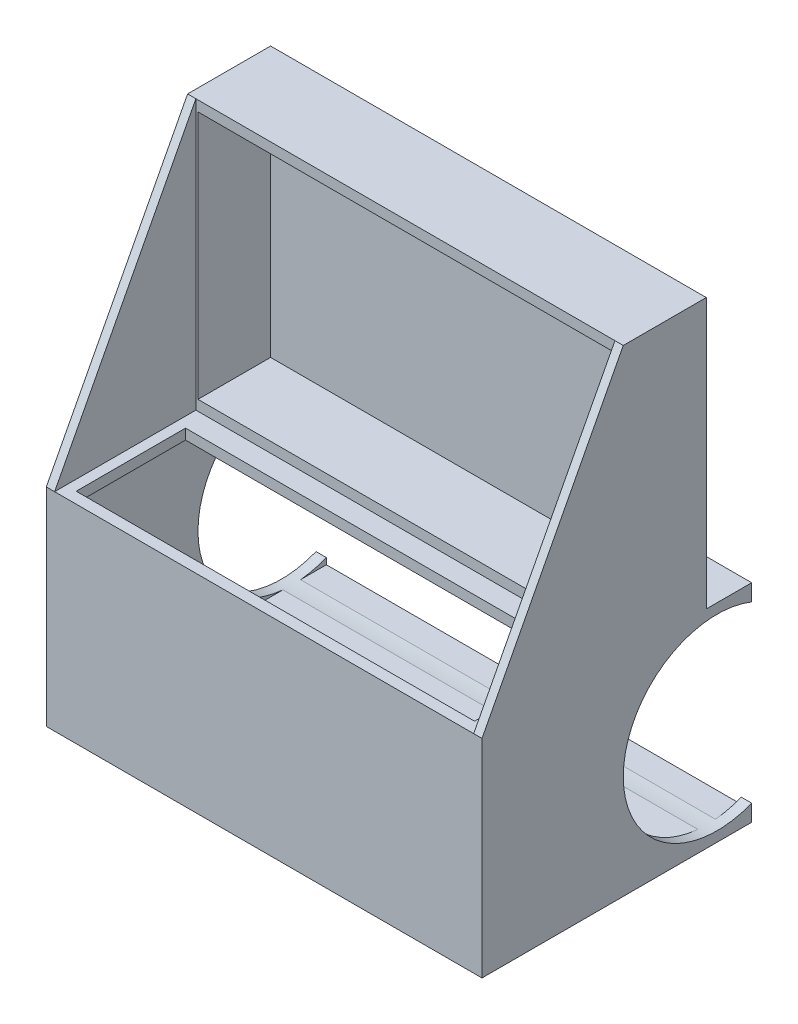
from build123d import *

# Parameters (mm, degrees)
SKETCH_2_W          = 210
SKETCH_2_H          = 100
EXTRUDE_1_DEPTH     = 130
SKETCH_3_W          = 200
SKETCH_3_H          = 90
CUT_EXTRUDE_1_DEPTH = 125
SKETCH_4_W          = 70
SKETCH_4_H          = 85
CUT_EXTRUDE_2_DEPTH = 125
CUT_EXTRUDE_4_DEPTH = 150
EXTRUDE_3_DEPTH     = 210
SKETCH_7_W          = 200
SKETCH_7_H          = 120
CUT_EXTRUDE_7_DEPTH = 35
EXTRUDE_6_DEPTH     = 4
EXTRUDE_7_DEPTH     = 4
SKETCH_13_W         = 192
SKETCH_13_H         = 52.689697424
CUT_EXTRUDE_9_DEPTH = 5


with BuildPart() as part:
    # 草图2 → 凸台-拉伸1 (new body)
    with BuildSketch(Plane.XY):
        Rectangle(SKETCH_2_W, SKETCH_2_H)
    extrude(amount=EXTRUDE_1_DEPTH)

    # 草图3 → 切除-拉伸1 (cut)
    with BuildSketch(Plane.XY):
        Rectangle(SKETCH_3_W, SKETCH_3_H)
    extrude(amount=CUT_EXTRUDE_1_DEPTH, mode=Mode.SUBTRACT)

    # 草图4 → 切除-拉伸2 (cut)
    with BuildSketch(Plane(origin=(0, 0, 0), x_dir=(1, 0, 0), z_dir=(0, 1, 0))):
        with Locations((0, -82.5)):
            Rectangle(SKETCH_4_W, SKETCH_4_H)
    extrude(amount=-CUT_EXTRUDE_2_DEPTH, mode=Mode.SUBTRACT)

    # 草图5 → 切除-拉伸4 (cut, symmetric)
    with BuildSketch(Plane(origin=(0, 0, 0), x_dir=(0, 0, -1), z_dir=(1, 0, 0))):
        with BuildLine():
            Line((0, 42), (0, -42))
            ThreePointArc((0, -42), (-61.900064838, 0), (0, 42))
        make_face()
    extrude(amount=CUT_EXTRUDE_4_DEPTH, both=True, mode=Mode.SUBTRACT)

    # 草图6 → 凸台-拉伸3 (add)
    with BuildSketch(Plane(origin=(105, 0, 0), x_dir=(0, 0, -1), z_dir=(1, 0, 0))):
        Polygon((-61.900064838, 50), (-61.900064838, 174.615745143), (-61.900064838, 180), (-21.900064838, 180), (-21.900064838, 50), align=None)
    extrude(amount=-EXTRUDE_3_DEPTH)

    # 草图7 → 切除-拉伸7 (cut)
    with BuildSketch(Plane.XY.offset(61.900064838)):
        with Locations((0, 115)):
            Rectangle(SKETCH_7_W, SKETCH_7_H)
    extrude(amount=-CUT_EXTRUDE_7_DEPTH, mode=Mode.SUBTRACT)

    # 草图11 → 凸台-拉伸6 (add)
    with BuildSketch(Plane(origin=(105, 0, 0), x_dir=(0, 0, -1), z_dir=(1, 0, 0))):
        Polygon((-130, 50), (-61.900064838, 180), (-61.900064838, 50), align=None)
    extrude(amount=-EXTRUDE_6_DEPTH)

    # 草图12 → 凸台-拉伸7 (add)
    with BuildSketch(Plane.ZY.offset(105)):
        Polygon((61.900064838, 180), (130, 50), (61.900064838, 50), align=None)
    extrude(amount=-EXTRUDE_7_DEPTH)

    # 草图13 → 切除-拉伸9 (cut)
    with BuildSketch(Plane(origin=(0, 50, 0), x_dir=(1, 0, 0), z_dir=(0, 1, 0))):
        with Locations((0, -98.24491355)):
            Rectangle(SKETCH_13_W, SKETCH_13_H)
    extrude(amount=-CUT_EXTRUDE_9_DEPTH, mode=Mode.SUBTRACT)


solid = part.part
